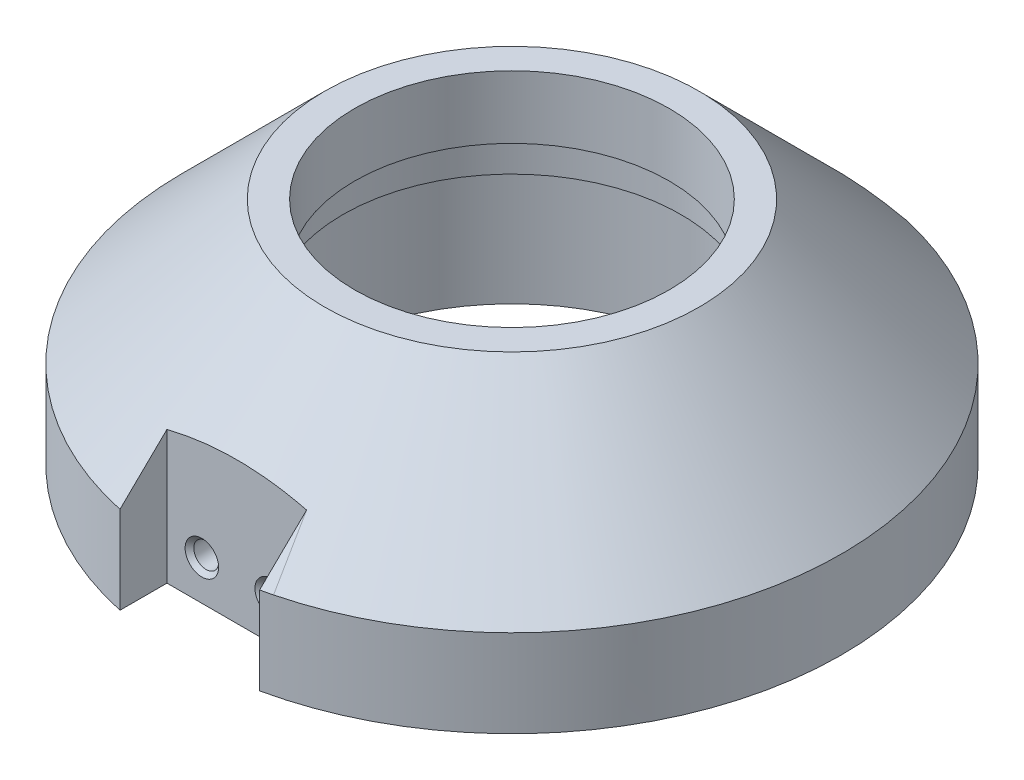
from build123d import *

# Parameters (mm, degrees)
SKETCH14_R                      = 29.972
BOSS_EXTRUDE1_DEPTH             = 5.4102
SKETCH15_W                      = 12.7
SKETCH15_H                      = 4.953
CUT_EXTRUDE2_DEPTH              = 48.261264749
F_4_40_TAPPED_HOLE1_D           = 2.2606
F_4_40_TAPPED_HOLE1_DEPTH       = 7.62
F_4_40_TAPPED_HOLE1_CSINK_D     = 3.048
F_4_40_TAPPED_HOLE1_CSINK_ANGLE = 90
F_4_40_TAPPED_HOLE1_TIP         = 0.679152758
CUT_EXTRUDE3_DEPTH              = 0.762
F_4_40_TAPPED_HOLE2_D           = 2.2606
F_4_40_TAPPED_HOLE2_DEPTH       = 7.62
F_4_40_TAPPED_HOLE2_CSINK_D     = 3.048
F_4_40_TAPPED_HOLE2_CSINK_ANGLE = 90
F_4_40_TAPPED_HOLE2_TIP         = 0.679152758
SKETCH24_R                      = 14.3002
CUT_EXTRUDE4_DEPTH              = 47.832730495
CUT_EXTRUDE5_START              = -15.1892
SKETCH25_R                      = 15.367
CUT_EXTRUDE5_DEPTH              = 15.1892
SKETCH26_R                      = 17.907
CUT_EXTRUDE6_DEPTH              = 12.0142
F_0_80_TAPPED_HOLE1_D           = 1.19126
F_0_80_TAPPED_HOLE1_DEPTH       = 7.62
F_0_80_TAPPED_HOLE1_TIP         = 0.357890611


with BuildPart() as part:
    # Sketch1 → Revolve1 (revolve)
    with BuildSketch(Plane.XY, mode=Mode.PRIVATE) as revolve1_sk:
        Polygon((0, 0), (29.972, 0), (29.972, 2.54), (17.018, 15.494), (0, 15.494), (0, 12.7), align=None)
    revolve(revolve1_sk.sketch.rotate(Axis((0, 12.7, 0), (0, -1, 0)), 180), axis=Axis((0, 12.7, 0), (0, -1, 0)))

    # Sketch14 → Boss-Extrude1 (add)
    with BuildSketch(Plane.XZ):
        with Locations(Location((0, 0, 0), (0, 0, 180))):
            Circle(SKETCH14_R)
    extrude(amount=BOSS_EXTRUDE1_DEPTH)

    # Sketch15 → Cut-Extrude2 (cut, through all)
    with BuildSketch(Plane.XZ.offset(5.4102)):
        with Locations((0, 27.4955)):
            Rectangle(SKETCH15_W, SKETCH15_H)
    extrude(amount=-CUT_EXTRUDE2_DEPTH, mode=Mode.SUBTRACT)

    # #4-40 Tapped Hole1
    with Locations(Plane.XY.offset(25.019)):
        with Locations((3.175, -1.8161), (-3.175, -1.8161)):
            CounterSinkHole(F_4_40_TAPPED_HOLE1_D / 2, F_4_40_TAPPED_HOLE1_CSINK_D / 2, depth=F_4_40_TAPPED_HOLE1_DEPTH, counter_sink_angle=F_4_40_TAPPED_HOLE1_CSINK_ANGLE)
            with Locations((0, 0, -(F_4_40_TAPPED_HOLE1_DEPTH + F_4_40_TAPPED_HOLE1_TIP / 2))):  # 118° drill point
                Cone(0, F_4_40_TAPPED_HOLE1_D / 2, F_4_40_TAPPED_HOLE1_TIP, mode=Mode.SUBTRACT)

    # Sketch20 → Cut-Extrude3 (cut)
    with BuildSketch(Plane(origin=(0, 0, -29.972), x_dir=(-1, 0, 0), z_dir=(0, 0, -1))):
        Polygon((-6.604, -5.4102), (6.604, -5.4102), (6.604, 2.54), (6.604, 6.759385605), (-6.604, 6.759385605), (-6.604, 2.54), align=None)
    extrude(amount=-CUT_EXTRUDE3_DEPTH, mode=Mode.SUBTRACT)

    # #4-40 Tapped Hole2
    with Locations(Plane(origin=(0, 0, -29.21), x_dir=(-1, 0, 0), z_dir=(0, 0, -1))):
        with Locations((-3.175, -1.44145), (3.175, -1.44145)):
            CounterSinkHole(F_4_40_TAPPED_HOLE2_D / 2, F_4_40_TAPPED_HOLE2_CSINK_D / 2, depth=F_4_40_TAPPED_HOLE2_DEPTH, counter_sink_angle=F_4_40_TAPPED_HOLE2_CSINK_ANGLE)
            with Locations((0, 0, -(F_4_40_TAPPED_HOLE2_DEPTH + F_4_40_TAPPED_HOLE2_TIP / 2))):  # 118° drill point
                Cone(0, F_4_40_TAPPED_HOLE2_D / 2, F_4_40_TAPPED_HOLE2_TIP, mode=Mode.SUBTRACT)

    # Sketch24 → Cut-Extrude4 (cut, through all)
    with BuildSketch(Plane.XZ.offset(5.4102)):
        Circle(SKETCH24_R)
    extrude(amount=-CUT_EXTRUDE4_DEPTH, mode=Mode.SUBTRACT)

    # Sketch25 → Cut-Extrude5 (cut)
    with BuildSketch(Plane.XZ.offset(5.4102).offset(CUT_EXTRUDE5_START)):
        Circle(SKETCH25_R)
    extrude(amount=CUT_EXTRUDE5_DEPTH, mode=Mode.SUBTRACT)

    # Sketch26 → Cut-Extrude6 (cut)
    with BuildSketch(Plane.XZ.offset(5.4102)):
        Circle(SKETCH26_R)
    extrude(amount=-CUT_EXTRUDE6_DEPTH, mode=Mode.SUBTRACT)

    # #0-80 Tapped Hole1
    with Locations(Plane(origin=(0, 6.604, 0), x_dir=(-1, 0, 0), z_dir=(0, -1, 0))):
        with Locations((11.557, -11.557), (-11.557, -11.557), (-11.557, 11.557), (11.557, 11.557)):
            Hole(F_0_80_TAPPED_HOLE1_D / 2, depth=F_0_80_TAPPED_HOLE1_DEPTH)
            with Locations((0, 0, -(F_0_80_TAPPED_HOLE1_DEPTH + F_0_80_TAPPED_HOLE1_TIP / 2))):  # 118° drill point
                Cone(0, F_0_80_TAPPED_HOLE1_D / 2, F_0_80_TAPPED_HOLE1_TIP, mode=Mode.SUBTRACT)


solid = part.part
